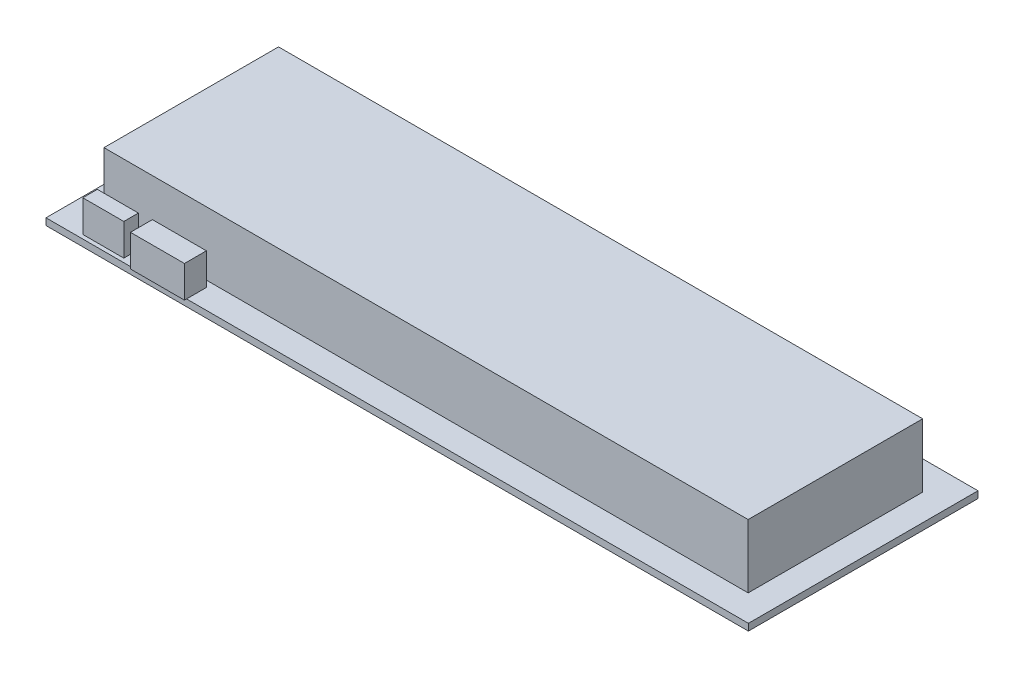
from build123d import *

# Parameters (mm, degrees)
SKETCH1_W           = 265.36
SKETCH1_H           = 86.74
BOSS_EXTRUDE1_DEPTH = 2.56
SKETCH2_W           = 243.36
SKETCH2_H           = 65.94
BOSS_EXTRUDE2_DEPTH = 24
SKETCH3_W           = 15.5
SKETCH3_H           = 5.5
SKETCH3_W_2         = 20.4
SKETCH3_H_2         = 8.3
BOSS_EXTRUDE3_DEPTH = 12


with BuildPart() as part:
    # Sketch1 → Boss-Extrude1 (new body)
    with BuildSketch(Plane(origin=(0, 0, 0), x_dir=(1, 0, 0), z_dir=(0, 1, 0))):
        with Locations((132.68, 43.37)):
            Rectangle(SKETCH1_W, SKETCH1_H)
    extrude(amount=BOSS_EXTRUDE1_DEPTH)

    # Sketch2 → Boss-Extrude2 (add)
    with BuildSketch(Plane(origin=(0, 2.56, 0), x_dir=(1, 0, 0), z_dir=(0, 1, 0))):
        with Locations((133.68, 42.87)):
            Rectangle(SKETCH2_W, SKETCH2_H)
    extrude(amount=BOSS_EXTRUDE2_DEPTH)

    # Sketch3 → Boss-Extrude3 (add)
    with BuildSketch(Plane(origin=(0, 2.56, 0), x_dir=(1, 0, 0), z_dir=(0, 1, 0))):
        with Locations((20.15, 4.25)):
            Rectangle(SKETCH3_W, SKETCH3_H)
        with Locations((42.9, 3.35)):
            Rectangle(SKETCH3_W_2, SKETCH3_H_2)
    extrude(amount=BOSS_EXTRUDE3_DEPTH)


solid = part.part
